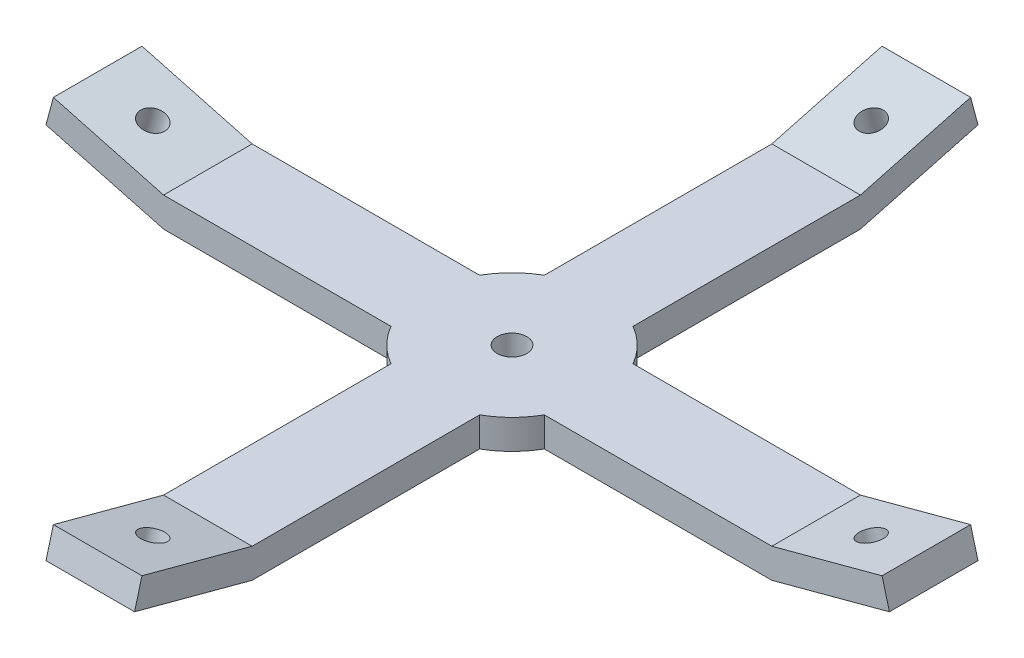
from build123d import *

# Parameters (mm, degrees)
EXTRUDE_1_DEPTH             = 5
EXTRUDE_6_DEPTH             = 15
EXTRUDE_7_DEPTH             = 15
EXTRUDE_8_DEPTH             = 15
EXTRUDE_9_DEPTH             = 15
HOLE_WIZARD_M61_D           = 5
HOLE_WIZARD_M51_D           = 4.2
HOLE_WIZARD_M51_ON_FACE_2_D = 4.2
HOLE_WIZARD_M51_ON_FACE_3_D = 4.2
HOLE_WIZARD_M51_ON_FACE_4_D = 4.2


with BuildPart() as part:
    # Эскиз1 → Бобышка-Вытянуть1 (new body)
    with BuildSketch(Plane(origin=(0, 0, 0), x_dir=(1, 0, 0), z_dir=(0, 1, 0))):
        with BuildLine():
            Line((-7.5, 51.5), (7.5, 51.5))
            Line((7.5, 51.5), (7.5, 12.990381057))
            ThreePointArc((7.5, 12.990381057), (10.606601718, 10.606601718), (12.990381057, 7.5))
            Line((12.990381057, 7.5), (51.5, 7.5))
            Line((51.5, 7.5), (51.5, -7.5))
            Line((51.5, -7.5), (12.990381057, -7.5))
            ThreePointArc((12.990381057, -7.5), (10.606601718, -10.606601718), (7.5, -12.990381057))
            Line((7.5, -12.990381057), (7.5, -51.5))
            Line((7.5, -51.5), (-7.5, -51.5))
            Line((-7.5, -51.5), (-7.5, -12.990381057))
            ThreePointArc((-7.5, -12.990381057), (-10.606601718, -10.606601718), (-12.990381057, -7.5))
            Line((-12.990381057, -7.5), (-51.5, -7.5))
            Line((-51.5, -7.5), (-51.5, 7.5))
            Line((-51.5, 7.5), (-12.990381057, 7.5))
            ThreePointArc((-12.990381057, 7.5), (-10.606601718, 10.606601718), (-7.5, 12.990381057))
            Line((-7.5, 12.990381057), (-7.5, 51.5))
        make_face()
    extrude(amount=EXTRUDE_1_DEPTH)

    # Эскиз2 → Бобышка-Вытянуть6 (add)
    with BuildSketch(Plane(origin=(7.5, 0, 0), x_dir=(0, 0, -1), z_dir=(1, 0, 0))):
        Polygon((-51.5, 0), (-71.410254038, 5.334936491), (-70.160254038, 10), (-51.5, 5), align=None)
    extrude(amount=-EXTRUDE_6_DEPTH)

    # Эскиз3 → Бобышка-Вытянуть7 (add)
    with BuildSketch(Plane(origin=(0, 0, -7.5), x_dir=(-1, 0, 0), z_dir=(0, 0, -1))):
        Polygon((-51.5, 0), (-71.410254038, 5.334936491), (-70.160254038, 10), (-51.5, 5), align=None)
    extrude(amount=-EXTRUDE_7_DEPTH)

    # Эскиз4 → Бобышка-Вытянуть8 (add)
    with BuildSketch(Plane.ZY.offset(7.5)):
        Polygon((-51.5, 0), (-71.410254038, 5.334936491), (-70.160254038, 10), (-51.5, 5), align=None)
    extrude(amount=-EXTRUDE_8_DEPTH)

    # Эскиз5 → Бобышка-Вытянуть9 (add)
    with BuildSketch(Plane.XY.offset(7.5)):
        Polygon((-51.5, 0), (-71.410254038, 5.334936491), (-70.160254038, 10), (-51.5, 5), align=None)
    extrude(amount=-EXTRUDE_9_DEPTH)

    # Отверстие обработанное метчиком M61 (through all)
    with Locations(Plane(origin=(0, 5, 0), x_dir=(1, 0, 0), z_dir=(0, 1, 0))):
        with Locations((0, 0)):
            Hole(HOLE_WIZARD_M61_D / 2)

    # Отверстие обработанное метчиком M51 (through all)
    with Locations(Plane(origin=(-60.830127019, 7.5, 0), x_dir=(0.965925826289, -0.258819045103, 0), z_dir=(0.258819045103, 0.965925826289, 0))):
        with Locations((0, 0)):
            Hole(HOLE_WIZARD_M51_D / 2)

    # Отверстие обработанное метчиком M51 on face 2 (through all)
    with Locations(Plane(origin=(0, 7.5, 60.830127019), x_dir=(0, 0.258818959594, 0.965925849201), z_dir=(0, 0.965925849201, -0.258818959594))):
        with Locations((0, 0)):
            Hole(HOLE_WIZARD_M51_ON_FACE_2_D / 2)

    # Отверстие обработанное метчиком M51 on face 3 (through all)
    with Locations(Plane(origin=(60.830127019, 7.5, 0), x_dir=(0.965925849201, 0.258818959594, 0), z_dir=(-0.258818959594, 0.965925849201, 0))):
        with Locations((0, 0)):
            Hole(HOLE_WIZARD_M51_ON_FACE_3_D / 2)

    # Отверстие обработанное метчиком M51 on face 4 (through all)
    with Locations(Plane(origin=(0, 7.5, -60.830127019), x_dir=(0, -0.258818959594, 0.965925849201), z_dir=(0, 0.965925849201, 0.258818959594))):
        with Locations((0, 0)):
            Hole(HOLE_WIZARD_M51_ON_FACE_4_D / 2)


solid = part.part
